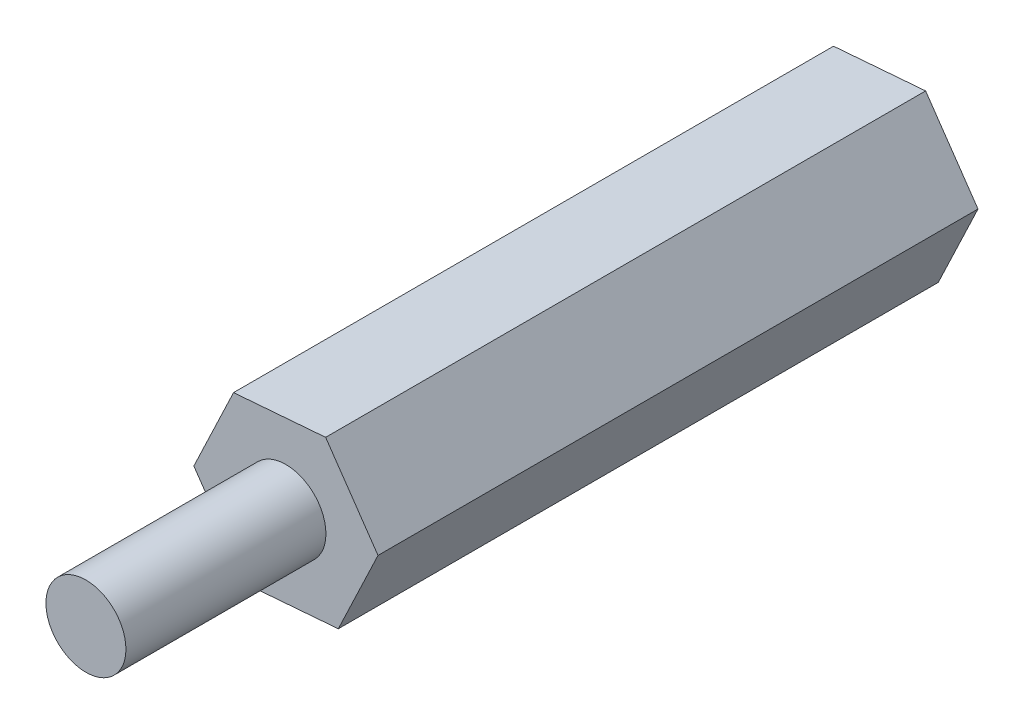
from build123d import *

# Parameters (mm, degrees)
BOSS_EXTRU_1_DEPTH      = 15
ESQUISSE2_R             = 1
BOSS_EXTRU_2_DEPTH      = 5
ESQUISSE3_R             = 1
ENL_V_MAT_EXTRU_1_DEPTH = 5


with BuildPart() as part:
    # Esquisse1 → Boss.-Extru.1 (new body)
    with BuildSketch(Plane.XY):
        Polygon((2.302144648, 0.182929919), (0.992650367, 2.085180707), (-1.309494281, 1.902250788), (-2.302144648, -0.182929919), (-0.992650367, -2.085180707), (1.309494281, -1.902250788), align=None)
    extrude(amount=BOSS_EXTRU_1_DEPTH)

    # Esquisse2 → Boss.-Extru.2 (add)
    with BuildSketch(Plane.XY.offset(15)):
        Circle(ESQUISSE2_R)
    extrude(amount=BOSS_EXTRU_2_DEPTH)

    # Esquisse3 → Enlèv. mat.-Extru.1 (cut)
    with BuildSketch(Plane(origin=(0, 0, 0), x_dir=(-1, 0, 0), z_dir=(0, 0, -1))):
        with Locations(Location((0, 0, 0), (0, 0, 180))):
            Circle(ESQUISSE3_R)
    extrude(amount=-ENL_V_MAT_EXTRU_1_DEPTH, mode=Mode.SUBTRACT)


solid = part.part
